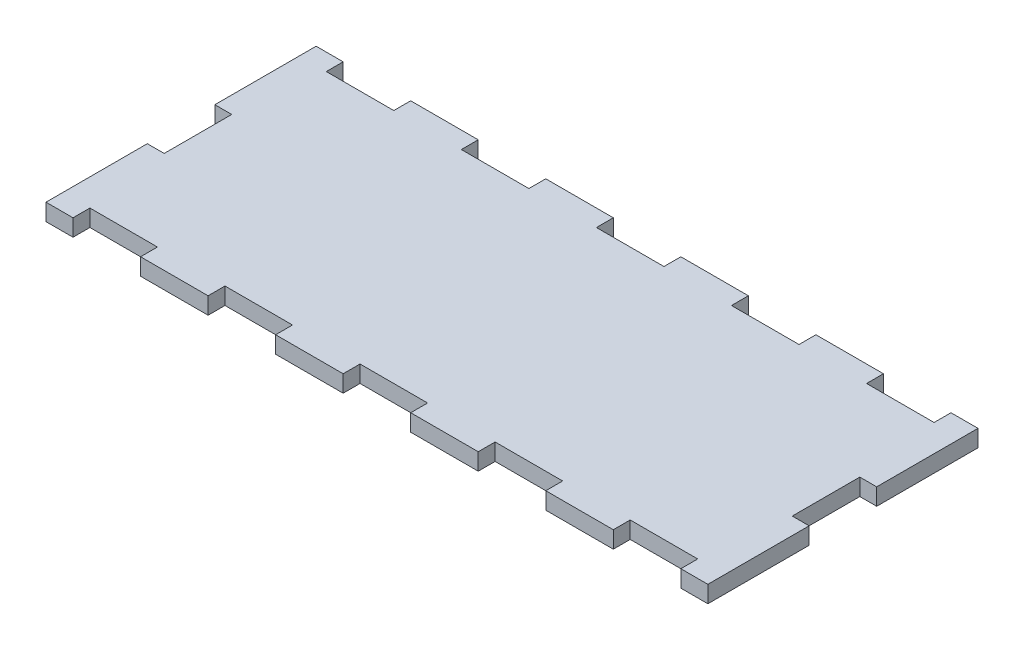
from build123d import *

# Parameters (mm, degrees)
SKETCH_1_W               = 196
SKETCH_1_H               = 80
EXTRUDE_1_DEPTH          = 5
CUT_EXTRUDE_1_REACH      = 107.967
SKETCH_2_W               = 20
SKETCH_2_H               = 5
PATTERN_LINEAR_1_COUNT   = 3
PATTERN_LINEAR_1_PITCH   = 40
PATTERN_LINEAR_2_COUNT   = 3
PATTERN_LINEAR_2_PITCH   = 40
CUT_EXTRUDE_2_REACH      = 107.967
SKETCH_3_W               = 5
SKETCH_3_H               = 20
MIRROR_2_COPY_1_REACH    = 107.967
MIRROR_2_COPY_1_SKETCH_W = 20
MIRROR_2_COPY_1_SKETCH_H = 5
MIRROR_2_COPY_2_REACH    = 107.967
MIRROR_2_COPY_2_SKETCH_W = 20
MIRROR_2_COPY_2_SKETCH_H = 5
MIRROR_2_COPY_3_REACH    = 107.967
MIRROR_2_COPY_3_SKETCH_W = 20
MIRROR_2_COPY_3_SKETCH_H = 5
MIRROR_2_COPY_4_REACH    = 107.967
MIRROR_2_COPY_4_SKETCH_W = 20
MIRROR_2_COPY_4_SKETCH_H = 5


with BuildPart() as part:
    # 스케치1 → 보스-돌출1 (new body)
    with BuildSketch(Plane(origin=(0, 0, 0), x_dir=(1, 0, 0), z_dir=(0, 1, 0))):
        Rectangle(SKETCH_1_W, SKETCH_1_H)
    extrude(amount=EXTRUDE_1_DEPTH)

    # 스케치2 → 컷-돌출1 (cut, up to next)
    with BuildSketch(Plane(origin=(0, 5, 0), x_dir=(1, 0, 0), z_dir=(0, 1, 0)), mode=Mode.PRIVATE) as cut_extrude_1_sk1:
        with Locations((0, -37.5)):
            Rectangle(SKETCH_2_W, SKETCH_2_H)
    cut_extrude_1_tool1 = extrude(cut_extrude_1_sk1.sketch, amount=-CUT_EXTRUDE_1_REACH, mode=Mode.PRIVATE) & part.part
    cut_extrude_1 = cut_extrude_1_tool1.solids().sort_by_distance((0, 5, 37.5))[0]
    add(cut_extrude_1, mode=Mode.SUBTRACT)

    # 선형 패턴1: 컷-돌출1 ×3
    with Locations(*[(i * PATTERN_LINEAR_1_PITCH, 0, 0) for i in range(1, PATTERN_LINEAR_1_COUNT)]):
        add(cut_extrude_1, mode=Mode.SUBTRACT)

    # 선형 패턴2: 컷-돌출1 ×3
    with Locations(*[(-i * PATTERN_LINEAR_2_PITCH, 0, 0) for i in range(1, PATTERN_LINEAR_2_COUNT)]):
        add(cut_extrude_1, mode=Mode.SUBTRACT)

    # 스케치3 → 컷-돌출2 (cut, up to next)
    with BuildSketch(Plane(origin=(0, 5, 0), x_dir=(1, 0, 0), z_dir=(0, 1, 0)), mode=Mode.PRIVATE) as cut_extrude_2_sk1:
        with Locations((95.5, 0)):
            Rectangle(SKETCH_3_W, SKETCH_3_H)
    cut_extrude_2_tool1 = extrude(cut_extrude_2_sk1.sketch, amount=-CUT_EXTRUDE_2_REACH, mode=Mode.PRIVATE) & part.part
    cut_extrude_2 = cut_extrude_2_tool1.solids().sort_by_distance((95.5, 5, 0))[0]
    add(cut_extrude_2, mode=Mode.SUBTRACT)

    # 대칭 복사2: 컷-돌출1 across plane
    add(cut_extrude_1.mirror(Plane.XY), mode=Mode.SUBTRACT)

    # 대칭 복사2 copy 1 sketch → 대칭 복사2 copy 1 (cut, up to next)
    with BuildSketch(Plane(origin=(40, 5, 0), x_dir=(1, 0, 0), z_dir=(0, 1, 0)), mode=Mode.PRIVATE) as mirror_2_copy_1_sk1:
        with Locations((0, 37.5)):
            Rectangle(MIRROR_2_COPY_1_SKETCH_W, MIRROR_2_COPY_1_SKETCH_H)
    mirror_2_copy_1_tool1 = extrude(mirror_2_copy_1_sk1.sketch, amount=-MIRROR_2_COPY_1_REACH, mode=Mode.PRIVATE) & part.part
    add(mirror_2_copy_1_tool1.solids().sort_by_distance((40, 5, -37.5))[0], mode=Mode.SUBTRACT)

    # 대칭 복사2 copy 2 sketch → 대칭 복사2 copy 2 (cut, up to next)
    with BuildSketch(Plane(origin=(80, 5, 0), x_dir=(1, 0, 0), z_dir=(0, 1, 0)), mode=Mode.PRIVATE) as mirror_2_copy_2_sk1:
        with Locations((0, 37.5)):
            Rectangle(MIRROR_2_COPY_2_SKETCH_W, MIRROR_2_COPY_2_SKETCH_H)
    mirror_2_copy_2_tool1 = extrude(mirror_2_copy_2_sk1.sketch, amount=-MIRROR_2_COPY_2_REACH, mode=Mode.PRIVATE) & part.part
    add(mirror_2_copy_2_tool1.solids().sort_by_distance((80, 5, -37.5))[0], mode=Mode.SUBTRACT)

    # 대칭 복사2 copy 3 sketch → 대칭 복사2 copy 3 (cut, up to next)
    with BuildSketch(Plane(origin=(-40, 5, 0), x_dir=(1, 0, 0), z_dir=(0, 1, 0)), mode=Mode.PRIVATE) as mirror_2_copy_3_sk1:
        with Locations((0, 37.5)):
            Rectangle(MIRROR_2_COPY_3_SKETCH_W, MIRROR_2_COPY_3_SKETCH_H)
    mirror_2_copy_3_tool1 = extrude(mirror_2_copy_3_sk1.sketch, amount=-MIRROR_2_COPY_3_REACH, mode=Mode.PRIVATE) & part.part
    add(mirror_2_copy_3_tool1.solids().sort_by_distance((-40, 5, -37.5))[0], mode=Mode.SUBTRACT)

    # 대칭 복사2 copy 4 sketch → 대칭 복사2 copy 4 (cut, up to next)
    with BuildSketch(Plane(origin=(-80, 5, 0), x_dir=(1, 0, 0), z_dir=(0, 1, 0)), mode=Mode.PRIVATE) as mirror_2_copy_4_sk1:
        with Locations((0, 37.5)):
            Rectangle(MIRROR_2_COPY_4_SKETCH_W, MIRROR_2_COPY_4_SKETCH_H)
    mirror_2_copy_4_tool1 = extrude(mirror_2_copy_4_sk1.sketch, amount=-MIRROR_2_COPY_4_REACH, mode=Mode.PRIVATE) & part.part
    add(mirror_2_copy_4_tool1.solids().sort_by_distance((-80, 5, -37.5))[0], mode=Mode.SUBTRACT)

    # 대칭 복사3: 컷-돌출2 across plane
    add(cut_extrude_2.mirror(Plane(origin=(0, 0, 0), x_dir=(0, 0, 1), z_dir=(1, 0, 0))), mode=Mode.SUBTRACT)


solid = part.part
